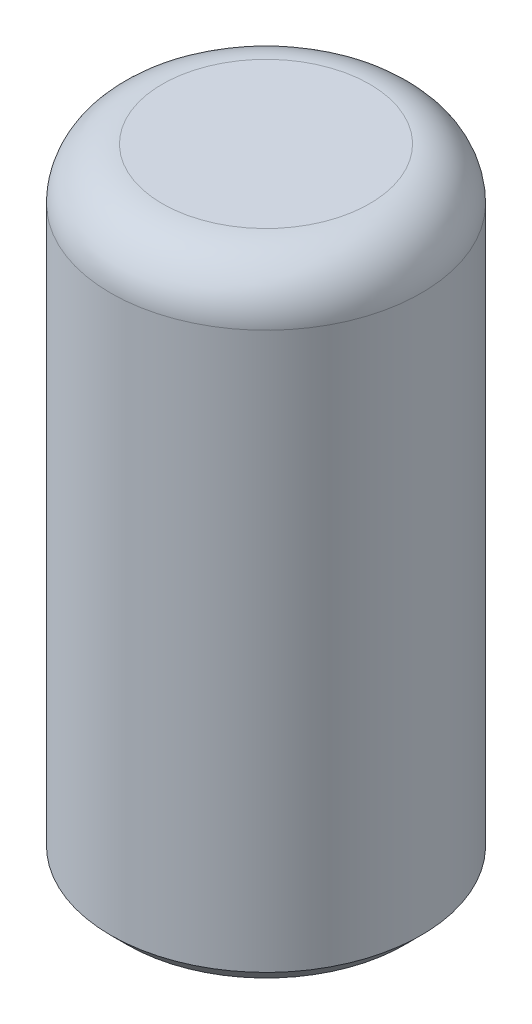
from build123d import *

# Parameters (mm, degrees)
CHAMFER1_SIZE             = 0.254
F_4_40_TAPPED_HOLE1_D     = 2.2606
F_4_40_TAPPED_HOLE1_DEPTH = 7.62
F_4_40_TAPPED_HOLE1_TIP   = 0.679152758


with BuildPart() as part:
    # Sketch1 → Revolve1 (revolve)
    with BuildSketch(Plane.XY):
        with BuildLine():
            Line((0, 0), (-2.36855, 0))
            Line((-2.36855, 0), (-2.36855, 8.7376))
            ThreePointArc((-2.36855, 8.7376), (-2.13792588, 9.29437588), (-1.58115, 9.525))
            Line((-1.58115, 9.525), (0, 9.525))
            Line((0, 9.525), (0, 0))
        make_face()
    revolve(axis=Axis((0, 0, 0), (0, 1, 0)))

    # Chamfer1
    chamfer1_edges = [part.edges().sort_by_distance(p)[0] for p in [
        (2.36855, 0, 0),
    ]]
    chamfer(chamfer1_edges, length=CHAMFER1_SIZE)

    # #4-40 Tapped Hole1
    with Locations(Plane(origin=(0, 0, 0), x_dir=(-1, 0, 0), z_dir=(0, -1, 0))):
        with Locations((0, 0)):
            Hole(F_4_40_TAPPED_HOLE1_D / 2, depth=F_4_40_TAPPED_HOLE1_DEPTH)
            with Locations((0, 0, -(F_4_40_TAPPED_HOLE1_DEPTH + F_4_40_TAPPED_HOLE1_TIP / 2))):  # 118° drill point
                Cone(0, F_4_40_TAPPED_HOLE1_D / 2, F_4_40_TAPPED_HOLE1_TIP, mode=Mode.SUBTRACT)


solid = part.part
